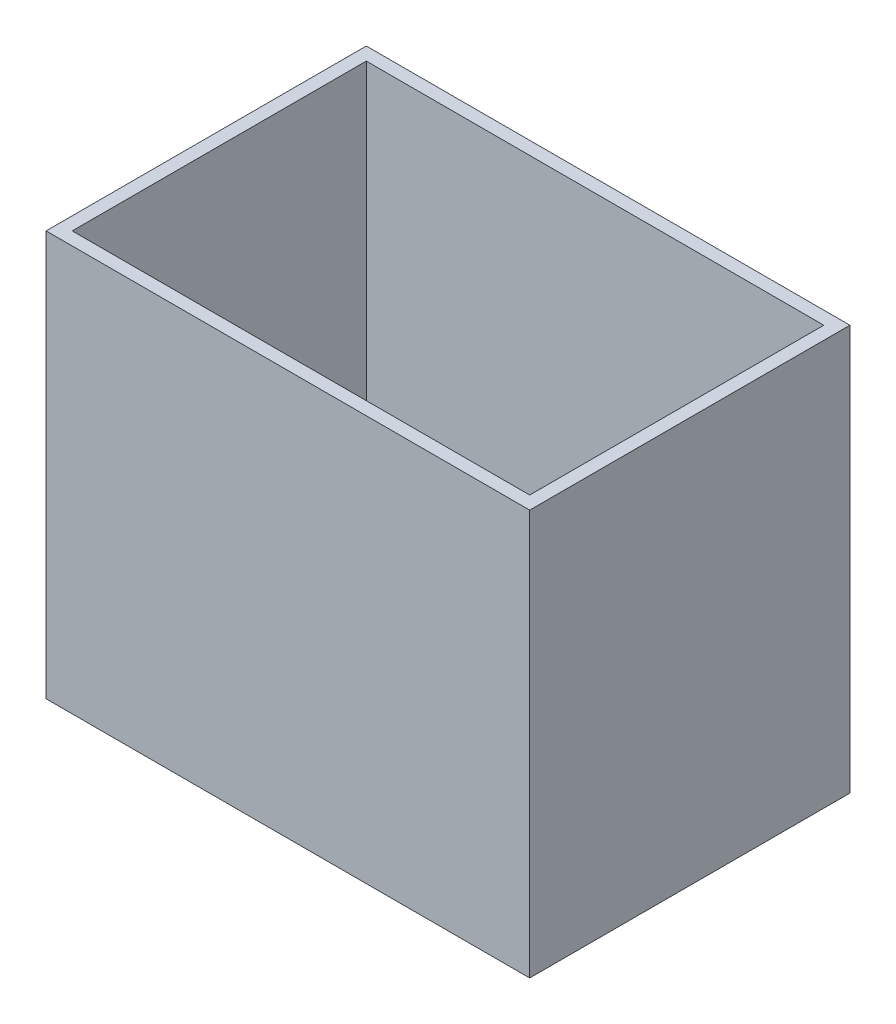
from build123d import *

# Parameters (mm, degrees)
SKETCH1_W           = 370
SKETCH1_H           = 245
BOSS_EXTRUDE1_DEPTH = 10
SKETCH2_W           = 370
SKETCH2_H           = 245
SKETCH2_W_2         = 350
SKETCH2_H_2         = 225
SKETCH2_H_3         = 5
BOSS_EXTRUDE3_DEPTH = 300
SKETCH3_W           = 350
SKETCH3_H           = 5
CUT_EXTRUDE1_DEPTH  = 45


with BuildPart() as part:
    # Sketch1 → Boss-Extrude1 (new body)
    with BuildSketch(Plane(origin=(0, 0, 0), x_dir=(1, 0, 0), z_dir=(0, 1, 0))):
        Rectangle(SKETCH1_W, SKETCH1_H)
    extrude(amount=BOSS_EXTRUDE1_DEPTH)

    # Sketch2 → Boss-Extrude3 (add)
    # profile 1 of 2: a face of its own
    with BuildSketch(Plane(origin=(0, 10, 0), x_dir=(1, 0, 0), z_dir=(0, 1, 0))):
        Rectangle(SKETCH2_W, SKETCH2_H)
        Rectangle(SKETCH2_W_2, SKETCH2_H_2, mode=Mode.SUBTRACT)
    # profile 2 of 2: a face of its own
    with BuildSketch(Plane(origin=(0, 10, 0), x_dir=(1, 0, 0), z_dir=(0, 1, 0))):
        with Locations((0, -70)):
            Rectangle(SKETCH2_W_2, SKETCH2_H_3)
    extrude(amount=BOSS_EXTRUDE3_DEPTH)

    # Sketch3 → Cut-Extrude1 (cut)
    with BuildSketch(Plane(origin=(0, 310, 0), x_dir=(1, 0, 0), z_dir=(0, 1, 0))):
        with Locations((0, -70)):
            Rectangle(SKETCH3_W, SKETCH3_H)
    extrude(amount=-CUT_EXTRUDE1_DEPTH, mode=Mode.SUBTRACT)


solid = part.part
